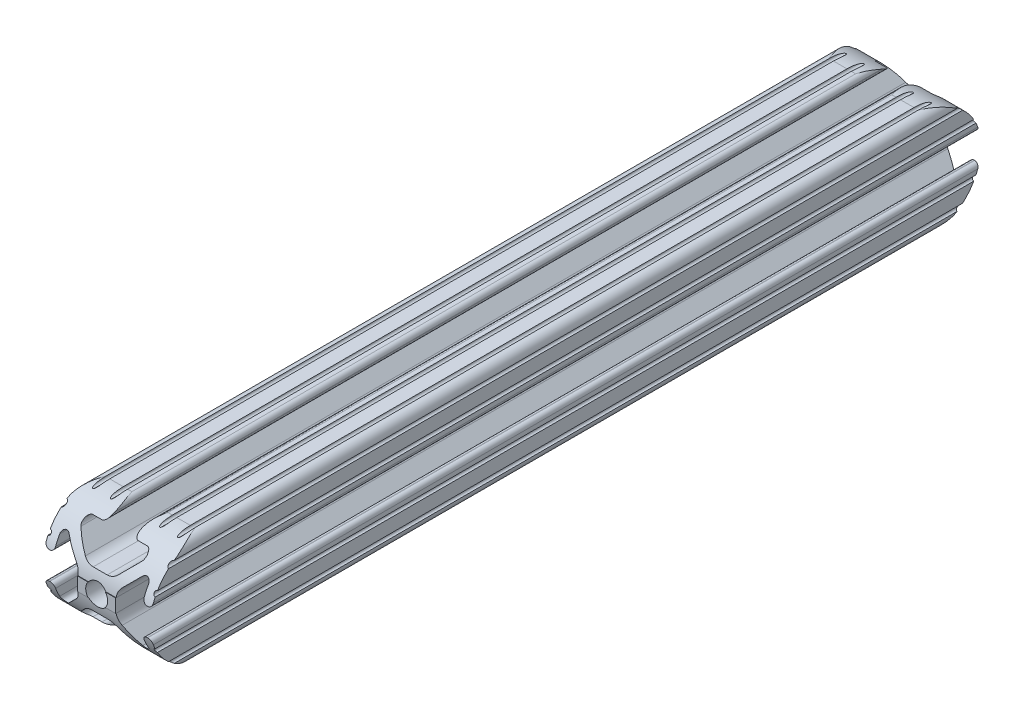
from build123d import *

# Parameters (mm, degrees)
SKETCH1_R               = 2.6035
BOSS_EXTRUDE1_DEPTH     = 98.425
CUT_EXTRUDE1_DEPTH      = 101.721909718
CUT_EXTRUDE1_DEPTH_BACK = 101.721909718
CUT_EXTRUDE2_DEPTH      = 101.721909846
CUT_EXTRUDE2_DEPTH_BACK = 101.721909846


with BuildPart() as part:
    # Sketch1 → Boss-Extrude1 (new, symmetric)
    with BuildSketch(Plane.XY):
        with BuildLine():
            Line((-7.179650497, -8.645192506), (-3.952270251, -5.423690499))
            ThreePointArc((-3.952270251, -5.423690499), (-2.922936451, -4.736929036), (-1.709253557, -4.4958))
            Line((-1.709253557, -4.4958), (1.709253557, -4.4958))
            ThreePointArc((1.709253557, -4.4958), (2.922936451, -4.736929036), (3.952270251, -5.423690499))
            Line((3.952270251, -5.423690499), (7.179650497, -8.645192506))
            ThreePointArc((7.179650497, -8.645192506), (7.41473083, -9.822813117), (6.416408329, -10.4902))
            Line((6.416408329, -10.4902), (4.287512407, -10.4902))
            ThreePointArc((4.287512407, -10.4902), (3.54574862, -10.79744862), (3.2385, -11.539212407))
            Line((3.2385, -11.539212407), (3.2385, -11.650987593))
            ThreePointArc((3.2385, -11.650987593), (3.54574862, -12.39275138), (4.287512407, -12.7))
            Line((4.287512407, -12.7), (5.317126718, -12.7))
            ThreePointArc((5.317126718, -12.7), (5.825126718, -12.192), (6.333126718, -12.7))
            Line((6.333126718, -12.7), (9.550443118, -12.7))
            ThreePointArc((9.550443118, -12.7), (10.058366869, -12.192000006), (10.566443095, -12.699847501))
            ThreePointArc((10.566443095, -12.699847501), (12.082537762, -12.08250727), (12.699846982, -10.566399977))
            ThreePointArc((12.699846982, -10.566399977), (12.192000006, -10.058323491), (12.7, -9.5504))
            Line((12.7, -9.5504), (12.7, -6.3330836))
            ThreePointArc((12.7, -6.3330836), (12.192, -5.8250836), (12.7, -5.3170836))
            Line((12.7, -5.3170836), (12.7, -4.287469289))
            ThreePointArc((12.7, -4.287469289), (12.39275138, -3.545705502), (11.650987593, -3.238456882))
            Line((11.650987593, -3.238456882), (11.539212407, -3.238456882))
            ThreePointArc((11.539212407, -3.238456882), (10.79744862, -3.545705502), (10.4902, -4.287469289))
            Line((10.4902, -4.287469289), (10.4902, -6.402089023))
            ThreePointArc((10.4902, -6.402089023), (9.856505071, -7.351067942), (8.737131347, -7.129408934))
            Line((8.737131347, -7.129408934), (5.441005833, -3.840816462))
            ThreePointArc((5.441005833, -3.840816462), (4.750877967, -2.809883091), (4.5085, -1.593185507))
            Line((4.5085, -1.593185507), (4.5085, 1.593185507))
            ThreePointArc((4.5085, 1.593185507), (4.750877967, 2.809883091), (5.441005833, 3.840816462))
            Line((5.441005833, 3.840816462), (8.737131347, 7.129408934))
            ThreePointArc((8.737131347, 7.129408934), (9.856505071, 7.351067942), (10.4902, 6.402089023))
            Line((10.4902, 6.402089023), (10.4902, 4.287469289))
            ThreePointArc((10.4902, 4.287469289), (10.79744862, 3.545705502), (11.539212407, 3.238456882))
            Line((11.539212407, 3.238456882), (11.650987593, 3.238456882))
            ThreePointArc((11.650987593, 3.238456882), (12.39275138, 3.545705502), (12.7, 4.287469289))
            Line((12.7, 4.287469289), (12.7, 5.3170836))
            ThreePointArc((12.7, 5.3170836), (12.192, 5.8250836), (12.7, 6.3330836))
            Line((12.7, 6.3330836), (12.7, 9.5504))
            ThreePointArc((12.7, 9.5504), (12.192000006, 10.058323491), (12.699846982, 10.566399977))
            ThreePointArc((12.699846982, 10.566399977), (12.082537762, 12.08250727), (10.566443095, 12.699847501))
            ThreePointArc((10.566443095, 12.699847501), (10.058366869, 12.192000006), (9.550443118, 12.7))
            Line((9.550443118, 12.7), (6.333126718, 12.7))
            ThreePointArc((6.333126718, 12.7), (5.825126718, 12.192), (5.317126718, 12.7))
            Line((5.317126718, 12.7), (4.287512407, 12.7))
            ThreePointArc((4.287512407, 12.7), (3.54574862, 12.39275138), (3.2385, 11.650987593))
            Line((3.2385, 11.650987593), (3.2385, 11.539212407))
            ThreePointArc((3.2385, 11.539212407), (3.54574862, 10.79744862), (4.287512407, 10.4902))
            Line((4.287512407, 10.4902), (6.476788598, 10.4902))
            ThreePointArc((6.476788598, 10.4902), (7.432222385, 9.85140422), (7.207036008, 8.724370562))
            Line((7.207036008, 8.724370562), (3.898272566, 5.423169045))
            ThreePointArc((3.898272566, 5.423169045), (2.869120213, 4.736787962), (1.655778399, 4.4958))
            Line((1.655778399, 4.4958), (-1.655778399, 4.4958))
            ThreePointArc((-1.655778399, 4.4958), (-2.869120213, 4.736787962), (-3.898272566, 5.423169045))
            Line((-3.898272566, 5.423169045), (-7.207036008, 8.724370562))
            ThreePointArc((-7.207036008, 8.724370562), (-7.432222385, 9.85140422), (-6.476788598, 10.4902))
            Line((-6.476788598, 10.4902), (-4.287512407, 10.4902))
            ThreePointArc((-4.287512407, 10.4902), (-3.54574862, 10.79744862), (-3.2385, 11.539212407))
            Line((-3.2385, 11.539212407), (-3.2385, 11.650987593))
            ThreePointArc((-3.2385, 11.650987593), (-3.54574862, 12.39275138), (-4.287512407, 12.7))
            Line((-4.287512407, 12.7), (-5.317126718, 12.7))
            ThreePointArc((-5.317126718, 12.7), (-5.825126718, 12.192), (-6.333126718, 12.7))
            Line((-6.333126718, 12.7), (-9.550443118, 12.7))
            ThreePointArc((-9.550443118, 12.7), (-10.058366869, 12.192000006), (-10.566443095, 12.699847501))
            ThreePointArc((-10.566443095, 12.699847501), (-12.082537762, 12.08250727), (-12.699846982, 10.566399977))
            ThreePointArc((-12.699846982, 10.566399977), (-12.192000006, 10.058323491), (-12.7, 9.5504))
            Line((-12.7, 9.5504), (-12.7, 6.3330836))
            ThreePointArc((-12.7, 6.3330836), (-12.192, 5.8250836), (-12.7, 5.3170836))
            Line((-12.7, 5.3170836), (-12.7, 4.287469289))
            ThreePointArc((-12.7, 4.287469289), (-12.39275138, 3.545705502), (-11.650987593, 3.238456882))
            Line((-11.650987593, 3.238456882), (-11.539212407, 3.238456882))
            ThreePointArc((-11.539212407, 3.238456882), (-10.79744862, 3.545705502), (-10.4902, 4.287469289))
            Line((-10.4902, 4.287469289), (-10.4902, 6.402089023))
            ThreePointArc((-10.4902, 6.402089023), (-9.856505071, 7.351067942), (-8.737131347, 7.129408934))
            Line((-8.737131347, 7.129408934), (-5.441005833, 3.840816462))
            ThreePointArc((-5.441005833, 3.840816462), (-4.750877967, 2.809883091), (-4.5085, 1.593185507))
            Line((-4.5085, 1.593185507), (-4.5085, -1.593185507))
            ThreePointArc((-4.5085, -1.593185507), (-4.750877967, -2.809883091), (-5.441005833, -3.840816462))
            Line((-5.441005833, -3.840816462), (-8.737131347, -7.129408934))
            ThreePointArc((-8.737131347, -7.129408934), (-9.856505071, -7.351067942), (-10.4902, -6.402089023))
            Line((-10.4902, -6.402089023), (-10.4902, -4.287469289))
            ThreePointArc((-10.4902, -4.287469289), (-10.79744862, -3.545705502), (-11.539212407, -3.238456882))
            Line((-11.539212407, -3.238456882), (-11.650987593, -3.238456882))
            ThreePointArc((-11.650987593, -3.238456882), (-12.39275138, -3.545705502), (-12.7, -4.287469289))
            Line((-12.7, -4.287469289), (-12.7, -5.3170836))
            ThreePointArc((-12.7, -5.3170836), (-12.192, -5.8250836), (-12.7, -6.3330836))
            Line((-12.7, -6.3330836), (-12.7, -9.5504))
            ThreePointArc((-12.7, -9.5504), (-12.192000006, -10.058323491), (-12.699846982, -10.566399977))
            ThreePointArc((-12.699846982, -10.566399977), (-12.082537762, -12.08250727), (-10.566443095, -12.699847501))
            ThreePointArc((-10.566443095, -12.699847501), (-10.058366869, -12.192000006), (-9.550443118, -12.7))
            Line((-9.550443118, -12.7), (-6.333126718, -12.7))
            ThreePointArc((-6.333126718, -12.7), (-5.825126718, -12.192), (-5.317126718, -12.7))
            Line((-5.317126718, -12.7), (-4.287512407, -12.7))
            ThreePointArc((-4.287512407, -12.7), (-3.54574862, -12.39275138), (-3.2385, -11.650987593))
            Line((-3.2385, -11.650987593), (-3.2385, -11.539212407))
            ThreePointArc((-3.2385, -11.539212407), (-3.54574862, -10.79744862), (-4.287512407, -10.4902))
            Line((-4.287512407, -10.4902), (-6.416408329, -10.4902))
            ThreePointArc((-6.416408329, -10.4902), (-7.41473083, -9.822813117), (-7.179650497, -8.645192506))
        make_face()
        Circle(SKETCH1_R, mode=Mode.SUBTRACT)
    extrude(amount=BOSS_EXTRUDE1_DEPTH, both=True)

    # Sketch2 → Cut-Extrude1 (cut, two sides: drawn at the far end of the back side and taken through both)
    with BuildSketch(Plane(origin=(4.5085, 0, 0), x_dir=(0, 0, -1), z_dir=(1, 0, 0)).offset(-CUT_EXTRUDE1_DEPTH_BACK)):
        with BuildLine():
            Line((-98.425, 12.7), (-98.425, 1.593185507))
            Line((-98.425, 1.593185507), (-98.324673009, 1.593185507))
            ThreePointArc((-98.324673009, 1.593185507), (-94.146429601, 9.506288628), (-85.787237014, 12.699847501))
            Line((-85.787237014, 12.699847501), (-98.425, 12.7))
        make_face()
        with BuildLine():
            Line((-98.324673009, -1.593185507), (-98.425, -1.593185507))
            Line((-98.425, -1.593185507), (-98.425, -12.7))
            Line((-98.425, -12.7), (-85.725, -12.7))
            ThreePointArc((-85.725, -12.7), (-94.123111218, -9.52689498), (-98.324673009, -1.593185507))
        make_face()
        with BuildLine():
            ThreePointArc((-88.471340281, 1.593185507), (-88.9, 0), (-88.471340281, -1.593185507))
            Line((-88.471340281, -1.593185507), (-82.978659719, -1.593185507))
            ThreePointArc((-82.978659719, -1.593185507), (-82.659037232, -0.824922605), (-82.55, 0))
            ThreePointArc((-82.55, 0), (-82.659037232, 0.824922605), (-82.978659719, 1.593185507))
            Line((-82.978659719, 1.593185507), (-88.471340281, 1.593185507))
        make_face()
        with BuildLine():
            ThreePointArc((-63.071340281, 1.593185507), (-63.5, 0), (-63.071340281, -1.593185507))
            Line((-63.071340281, -1.593185507), (-57.578659719, -1.593185507))
            ThreePointArc((-57.578659719, -1.593185507), (-57.259037232, -0.824922605), (-57.15, 0))
            ThreePointArc((-57.15, 0), (-57.259037232, 0.824922605), (-57.578659719, 1.593185507))
            Line((-57.578659719, 1.593185507), (-63.071340281, 1.593185507))
        make_face()
        with BuildLine():
            ThreePointArc((-57.578659719, 1.593185507), (-60.325, 3.175), (-63.071340281, 1.593185507))
            Line((-63.071340281, 1.593185507), (-57.578659719, 1.593185507))
        make_face()
        with BuildLine():
            Line((-57.578659719, -1.593185507), (-63.071340281, -1.593185507))
            ThreePointArc((-63.071340281, -1.593185507), (-60.325, -3.175), (-57.578659719, -1.593185507))
        make_face()
        with BuildLine():
            Line((-82.978659719, -1.593185507), (-88.471340281, -1.593185507))
            ThreePointArc((-88.471340281, -1.593185507), (-85.725, -3.175), (-82.978659719, -1.593185507))
        make_face()
        with BuildLine():
            ThreePointArc((-82.978659719, 1.593185507), (-85.725, 3.175), (-88.471340281, 1.593185507))
            Line((-88.471340281, 1.593185507), (-82.978659719, 1.593185507))
        make_face()
        Polygon((-85.787237014, 12.699847501), (-98.425, 12.7), (-98.425, 13.97), (-85.787237014, 13.97), align=None)
    extrude(amount=CUT_EXTRUDE1_DEPTH + CUT_EXTRUDE1_DEPTH_BACK, mode=Mode.SUBTRACT)

    # Sketch3 → Cut-Extrude2 (cut, two sides: drawn at the far end of the back side and taken through both)
    with BuildSketch(Plane(origin=(4.5085, 0, 0), x_dir=(0, 0, -1), z_dir=(1, 0, 0)).offset(-CUT_EXTRUDE2_DEPTH_BACK)):
        with BuildLine():
            Line((98.425, 12.7), (85.725, 12.7))
            ThreePointArc((85.725, 12.7), (94.123111218, 9.52689498), (98.324673009, 1.593185507))
            Line((98.324673009, 1.593185507), (98.425, 1.593185507))
            Line((98.425, 1.593185507), (98.425, 12.7))
        make_face()
        with BuildLine():
            Line((98.425, -12.7), (98.425, -1.593185507))
            Line((98.425, -1.593185507), (98.324673009, -1.593185507))
            ThreePointArc((98.324673009, -1.593185507), (94.123111218, -9.52689498), (85.725, -12.7))
            Line((85.725, -12.7), (98.425, -12.7))
        make_face()
    extrude(amount=CUT_EXTRUDE2_DEPTH + CUT_EXTRUDE2_DEPTH_BACK, mode=Mode.SUBTRACT)


solid = part.part
